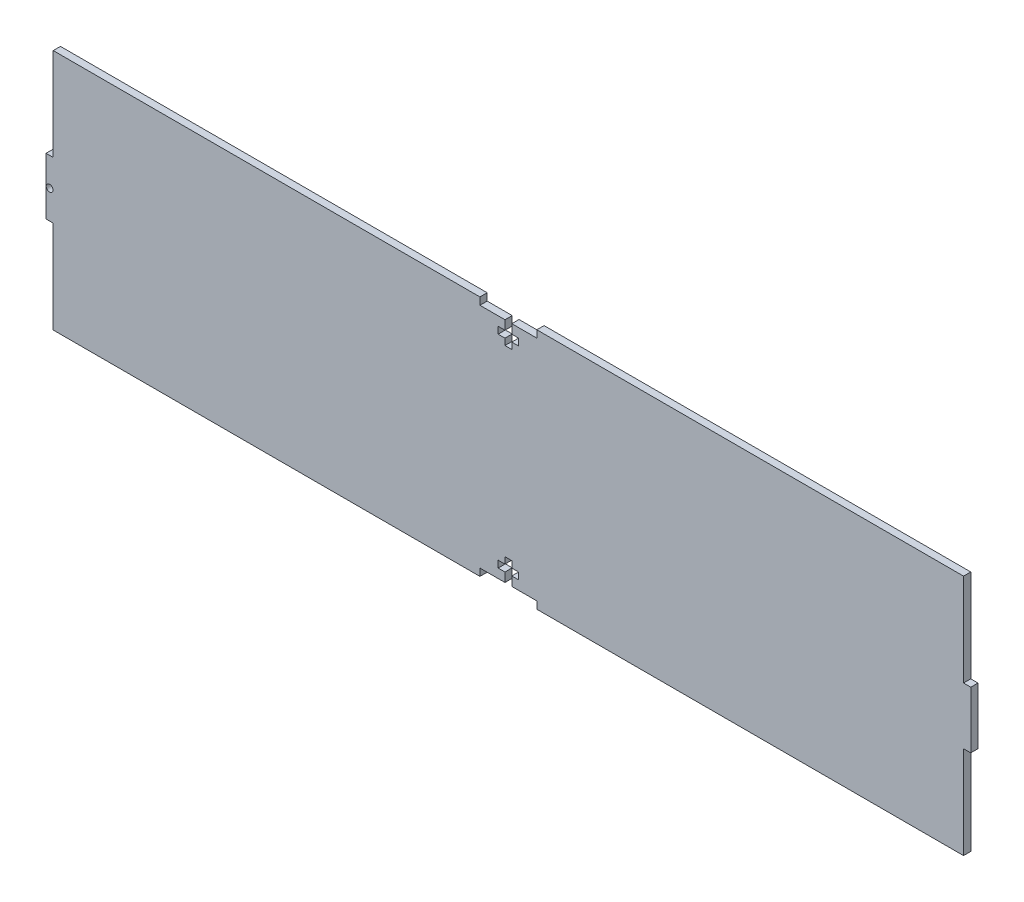
from build123d import *

# Parameters (mm, degrees)
SKETCH1_R           = 1.5
BOSS_EXTRUDE1_DEPTH = 3.18


with BuildPart() as part:
    # Sketch1 → Boss-Extrude1 (new body)
    with BuildSketch(Plane.XY):
        Polygon((-200, 53.18), (-12.5, 53.18), (-12.5, 50), (-1.5, 50), (-1.5, 46), (-4.5, 46), (-4.5, 43), (-1.5, 43), (-1.5, 40.18), (1.5, 40.18), (1.5, 43), (4.5, 43), (4.5, 46), (1.5, 46), (1.5, 50), (12.5, 50), (12.5, 53.18), (200, 53.18), (200, 12.5), (203.18, 12.5), (203.18, -12.5), (200, -12.5), (200, -53.18), (12.5, -53.18), (12.5, -50), (1.5, -50), (1.5, -46), (4.5, -46), (4.5, -43), (1.5, -43), (1.5, -40.18), (-1.5, -40.18), (-1.5, -43), (-4.5, -43), (-4.5, -46), (-1.5, -46), (-1.5, -50), (-12.5, -50), (-12.5, -53.18), (-200, -53.18), (-200, -12.5), (-203.18, -12.5), (-203.18, 12.5), (-200, 12.5), align=None)
        with Locations(Location((-201.59, 0, 0), (0, 0, 180))):
            Circle(SKETCH1_R, mode=Mode.SUBTRACT)
    extrude(amount=BOSS_EXTRUDE1_DEPTH)


solid = part.part
